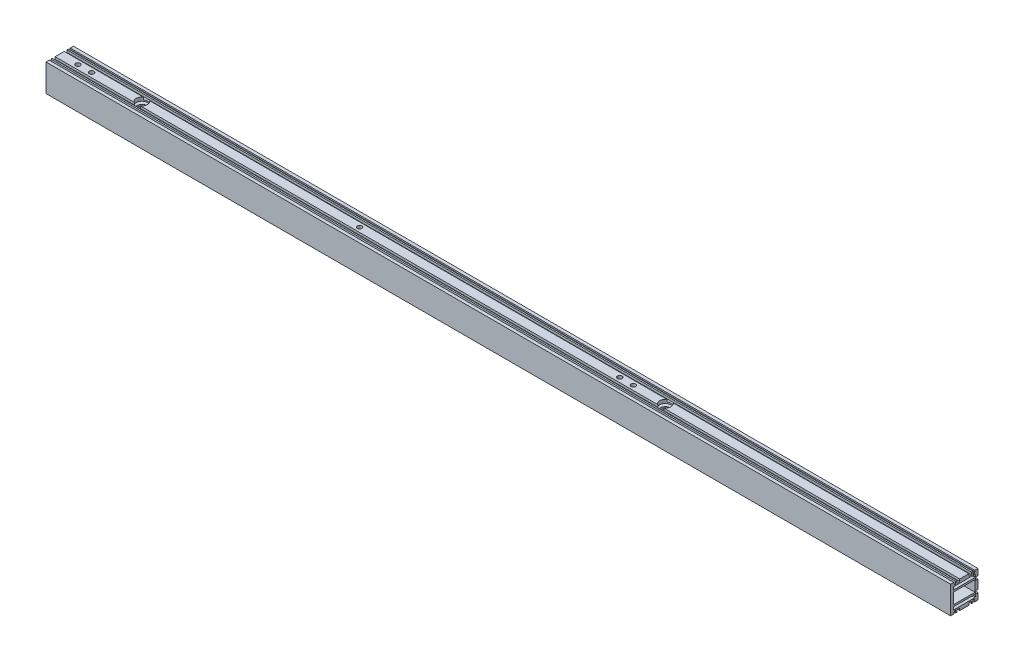
from build123d import *

# Parameters (mm, degrees)
SKETCH_1_W              = 23.5
SKETCH_1_H              = 12
EXTRUDE_1_DEPTH         = 495.5
HOLE_WIZARD_M6_1_D      = 5
HOLE_WIZARD_M6_1_DEPTH  = 19
HOLE_WIZARD_M6_1_TIP    = 1.502151548
HOLE_WIZARD_M6_2_D      = 5
HOLE_WIZARD_M6_2_DEPTH  = 19
HOLE_WIZARD_M6_2_TIP    = 1.502151548
HOLE_WIZARD_M6_3_D      = 5
HOLE_WIZARD_M6_3_DEPTH  = 19
HOLE_WIZARD_M6_3_TIP    = 1.502151548
HOLE_WIZARD_12_0_12_1_D = 12
HOLE_WIZARD_M4_1_D      = 3.3
HOLE_WIZARD_M4_1_DEPTH  = 11.5
HOLE_WIZARD_M4_1_TIP    = 0.991420021


with BuildPart() as part:
    # 草图1 → 凸台-拉伸1 (new, symmetric)
    with BuildSketch(Plane(origin=(0, 0, 0), x_dir=(0, 0, -1), z_dir=(1, 0, 0))):
        Polygon((-15, 15), (-11.5, 15), (-11.5, 13.5), (-11, 13.5), (-11, 12), (-9.5, 12), (-9.5, 15), (-8, 15), (-8, 12.5), (-5, 12.5), (-5, 15), (5, 15), (5, 12.5), (8, 12.5), (8, 15), (9.5, 15), (9.5, 12), (11, 12), (11, 13.5), (11.5, 13.5), (11.5, 15), (15, 15), (15, 8), (12.5, 8), (12.5, 5), (15, 5), (15, -5), (12.5, -5), (12.5, -8), (15, -8), (15, -15), (11.5, -15), (11.5, -13.5), (11, -13.5), (11, -12), (9.5, -12), (9.5, -15), (8, -15), (8, -12.5), (5, -12.5), (5, -15), (-5, -15), (-5, -12.5), (-8, -12.5), (-8, -15), (-9.5, -15), (-9.5, -12), (-11, -12), (-11, -13.5), (-11.5, -13.5), (-11.5, -15), (-15, -15), align=None)
        with BuildLine():
            Line((12, -10.5), (12, -8.5))
            ThreePointArc((12, -8.5), (11.853553391, -8.146446609), (11.5, -8))
            Line((11.5, -8), (-11.5, -8))
            ThreePointArc((-11.5, -8), (-11.853553391, -8.146446609), (-12, -8.5))
            Line((-12, -8.5), (-12, -10.5))
            ThreePointArc((-12, -10.5), (-11.853553391, -10.853553391), (-11.5, -11))
            Line((-11.5, -11), (11.5, -11))
            ThreePointArc((11.5, -11), (11.853553391, -10.853553391), (12, -10.5))
        make_face(mode=Mode.SUBTRACT)
        with BuildLine():
            Line((-11.5, 11), (11.5, 11))
            ThreePointArc((11.5, 11), (11.853553391, 10.853553391), (12, 10.5))
            Line((12, 10.5), (12, 8.5))
            ThreePointArc((12, 8.5), (11.853553391, 8.146446609), (11.5, 8))
            Line((11.5, 8), (-11.5, 8))
            ThreePointArc((-11.5, 8), (-11.853553391, 8.146446609), (-12, 8.5))
            Line((-12, 8.5), (-12, 10.5))
            ThreePointArc((-12, 10.5), (-11.853553391, 10.853553391), (-11.5, 11))
        make_face(mode=Mode.SUBTRACT)
        Rectangle(SKETCH_1_W, SKETCH_1_H, mode=Mode.SUBTRACT)
    extrude(amount=EXTRUDE_1_DEPTH, both=True)

    # M6 螺纹孔1
    with Locations(Plane(origin=(0, -15, 0), x_dir=(-1, 0, 0), z_dir=(0, -1, 0))):
        with Locations((-445.5, 0), (-430.5, 0), (230.5, 0), (245.5, 0), (460.5, 0), (475.5, 0)):
            Hole(HOLE_WIZARD_M6_1_D / 2, depth=HOLE_WIZARD_M6_1_DEPTH)
            with Locations((0, 0, -(HOLE_WIZARD_M6_1_DEPTH + HOLE_WIZARD_M6_1_TIP / 2))):  # 118° drill point
                Cone(0, HOLE_WIZARD_M6_1_D / 2, HOLE_WIZARD_M6_1_TIP, mode=Mode.SUBTRACT)

    # M6 螺纹孔2
    with Locations(Plane(origin=(0, 0, -15), x_dir=(-1, 0, 0), z_dir=(0, 0, -1))):
        with Locations((-445.5, 0), (-430.5, 0), (-370.5, 0), (-266.5, 0), (-394.5, 0)):
            Hole(HOLE_WIZARD_M6_2_D / 2, depth=HOLE_WIZARD_M6_2_DEPTH)
            with Locations((0, 0, -(HOLE_WIZARD_M6_2_DEPTH + HOLE_WIZARD_M6_2_TIP / 2))):  # 118° drill point
                Cone(0, HOLE_WIZARD_M6_2_D / 2, HOLE_WIZARD_M6_2_TIP, mode=Mode.SUBTRACT)

    # M6 螺纹孔3
    with Locations(Plane(origin=(0, 15, 0), x_dir=(1, 0, 0), z_dir=(0, 1, 0))):
        with Locations((133, 0), (118, 0), (-460.5, 0), (-475.5, 0), (-167, 0)):
            Hole(HOLE_WIZARD_M6_3_D / 2, depth=HOLE_WIZARD_M6_3_DEPTH)
            with Locations((0, 0, -(HOLE_WIZARD_M6_3_DEPTH + HOLE_WIZARD_M6_3_TIP / 2))):  # 118° drill point
                Cone(0, HOLE_WIZARD_M6_3_D / 2, HOLE_WIZARD_M6_3_TIP, mode=Mode.SUBTRACT)

    # Ø12.0 (12) 直径孔1 (through all)
    with Locations(Plane(origin=(0, -15, 0), x_dir=(-1, 0, 0), z_dir=(0, -1, 0))):
        with Locations((-168, 0), (405.5, 0)):
            Hole(HOLE_WIZARD_12_0_12_1_D / 2)

    # M4 螺纹孔1
    with Locations(Plane(origin=(0, 0, -15), x_dir=(-1, 0, 0), z_dir=(0, 0, -1))):
        with Locations((-341, 0), (-296, 0), (-236, 0), (-191, 0)):
            Hole(HOLE_WIZARD_M4_1_D / 2, depth=HOLE_WIZARD_M4_1_DEPTH)
            with Locations((0, 0, -(HOLE_WIZARD_M4_1_DEPTH + HOLE_WIZARD_M4_1_TIP / 2))):  # 118° drill point
                Cone(0, HOLE_WIZARD_M4_1_D / 2, HOLE_WIZARD_M4_1_TIP, mode=Mode.SUBTRACT)


solid = part.part
